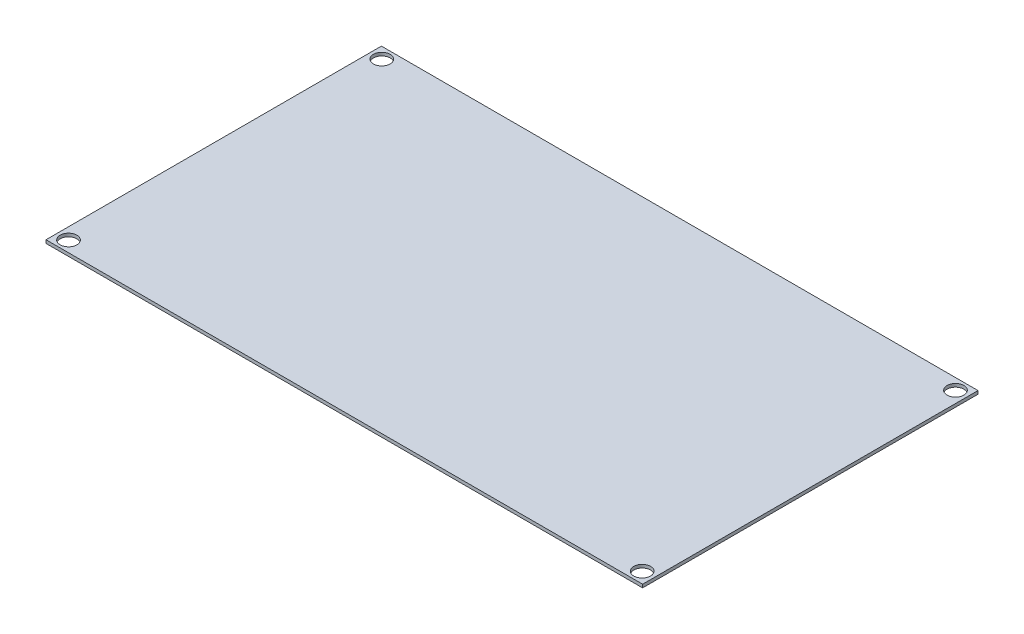
from build123d import *

# Parameters (mm, degrees)
SKETCH1_W           = 185
SKETCH1_H           = 104
SKETCH1_R           = 2.6
BOSS_EXTRUDE1_DEPTH = 1


with BuildPart() as part:
    # Sketch1 → Boss-Extrude1 (new body)
    with BuildSketch(Plane(origin=(0, 0, 0), x_dir=(1, 0, 0), z_dir=(0, 1, 0))):
        Rectangle(SKETCH1_W, SKETCH1_H)
        with Locations(Location((-88.94, 48.575, 0), (0, 0, 270))):
            Circle(SKETCH1_R, mode=Mode.SUBTRACT)
        with Locations(Location((88.94, 48.575, 0), (0, 0, 90))):
            Circle(SKETCH1_R, mode=Mode.SUBTRACT)
        with Locations(Location((88.94, -48.575, 0), (0, 0, 270))):
            Circle(SKETCH1_R, mode=Mode.SUBTRACT)
        with Locations(Location((-88.94, -48.575, 0), (0, 0, 90))):
            Circle(SKETCH1_R, mode=Mode.SUBTRACT)
    extrude(amount=BOSS_EXTRUDE1_DEPTH)


solid = part.part
